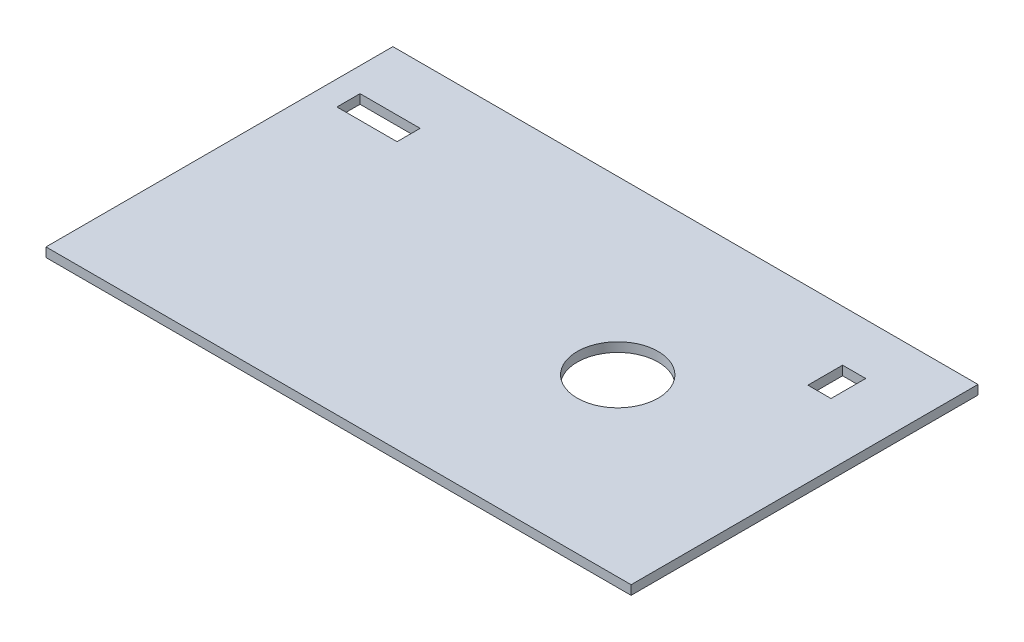
from build123d import *

# Parameters (mm, degrees)
SKETCH2_W           = 253
SKETCH2_H           = 150
BOSS_EXTRUDE1_DEPTH = 4
SKETCH3_R           = 17.5
SKETCH3_W           = 26
SKETCH3_H           = 10
SKETCH3_W_2         = 10
SKETCH3_H_2         = 15
CUT_EXTRUDE1_DEPTH  = 148.116450474


with BuildPart() as part:
    # Sketch2 → Boss-Extrude1 (new body)
    with BuildSketch(Plane(origin=(0, 0, 0), x_dir=(1, 0, 0), z_dir=(0, 1, 0))):
        Rectangle(SKETCH2_W, SKETCH2_H)
    extrude(amount=BOSS_EXTRUDE1_DEPTH)

    # Sketch3 → Cut-Extrude1 (cut, through all)
    with BuildSketch(Plane(origin=(0, 4, 0), x_dir=(1, 0, 0), z_dir=(0, 1, 0))):
        with Locations(Location((45, 0.713202338, 0), (0, 0, 270))):
            Circle(SKETCH3_R)
        with Locations((-103, 45.288057663)):
            Rectangle(SKETCH3_W, SKETCH3_H)
        with Locations((95, 45.445405543)):
            Rectangle(SKETCH3_W_2, SKETCH3_H_2)
    extrude(amount=-CUT_EXTRUDE1_DEPTH, mode=Mode.SUBTRACT)


solid = part.part
